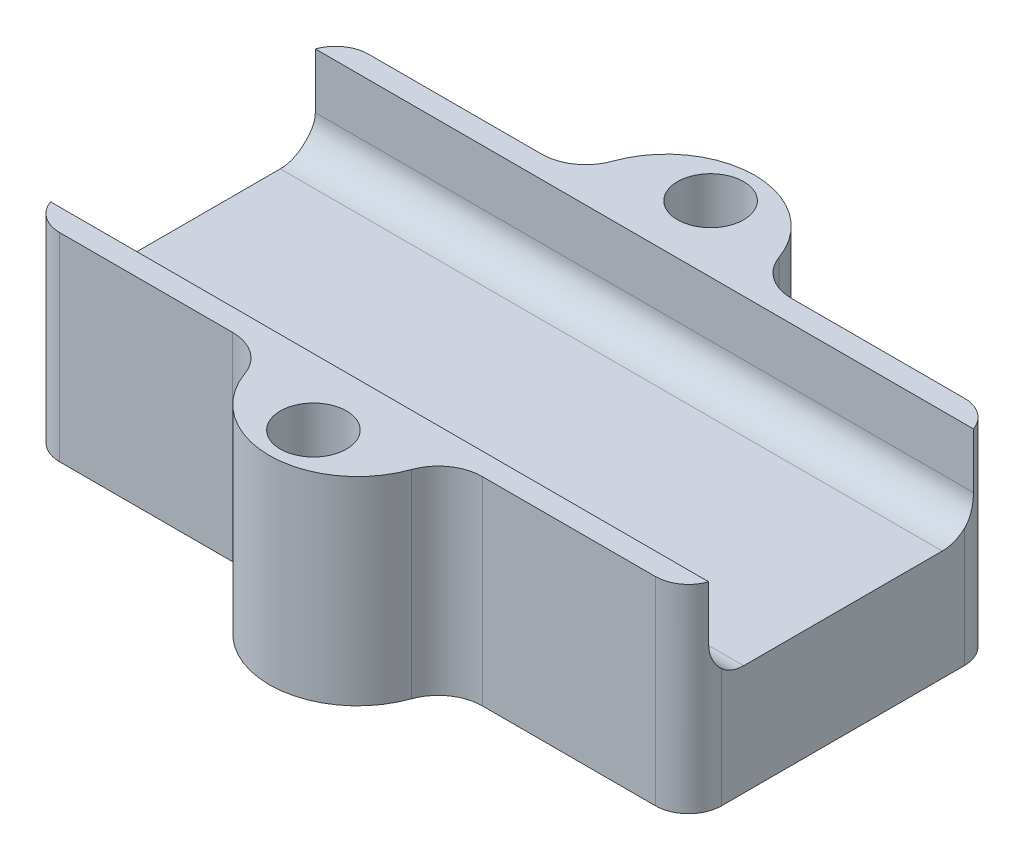
from build123d import *

# Parameters (mm, degrees)
BOSS_EXTRUDE1_DEPTH = 9
SKETCH2_W           = 30
SKETCH2_H           = 12
CUT_EXTRUDE1_DEPTH  = 4
FILLET1_R           = 2
FILLET2_R           = 1.5
SKETCH3_R           = 1.5
CUT_EXTRUDE2_DEPTH  = 21.66397832
SKETCH5_W           = 0.352564103
SKETCH5_H           = 2.5
BOSS_EXTRUDE2_DEPTH = 0.8
FILLET3_R           = 1.5


with BuildPart() as part:
    # Sketch1 → Boss-Extrude1 (new body)
    with BuildSketch(Plane(origin=(0, 0, 0), x_dir=(1, 0, 0), z_dir=(0, 1, 0))):
        with BuildLine():
            Line((-15, 7), (-4, 7))
            ThreePointArc((-4, 7), (0, 11), (4, 7))
            Line((4, 7), (15, 7))
            Line((15, 7), (15, -7))
            Line((15, -7), (4, -7))
            ThreePointArc((4, -7), (0, -11), (-4, -7))
            Line((-4, -7), (-15, -7))
            Line((-15, -7), (-15, 7))
        make_face()
    extrude(amount=BOSS_EXTRUDE1_DEPTH)

    # Sketch2 → Cut-Extrude1 (cut)
    with BuildSketch(Plane(origin=(0, 9, 0), x_dir=(1, 0, 0), z_dir=(0, 1, 0))):
        Rectangle(SKETCH2_W, SKETCH2_H)
    extrude(amount=-CUT_EXTRUDE1_DEPTH, mode=Mode.SUBTRACT)

    # Fillet1
    fillet1_edges = [part.edges().sort_by_distance(p)[0] for p in [
        (4, 4.5, 7),
        (-4, 4.5, 7),
        (-4, 4.5, -7),
        (4, 4.5, -7),
    ]]
    fillet(fillet1_edges, radius=FILLET1_R)

    # Fillet2
    fillet2_edges = [part.edges().sort_by_distance(p)[0] for p in [
        (15, 4.5, -7),
        (15, 4.5, 7),
        (-15, 4.5, 7),
        (-15, 4.5, -7),
    ]]
    fillet(fillet2_edges, radius=FILLET2_R)

    # Sketch3 → Cut-Extrude2 (cut, through all)
    with BuildSketch(Plane.XZ):
        with Locations(Location((0, 9, 0), (0, 0, 270))):
            Circle(SKETCH3_R)
        with Locations(Location((0, -9, 0), (0, 0, 270))):
            Circle(SKETCH3_R)
    extrude(amount=-CUT_EXTRUDE2_DEPTH, mode=Mode.SUBTRACT)

    # Sketch5 → Boss-Extrude2 (add)
    # profile 1 of 4: a face of its own
    with BuildSketch(Plane.ZY.offset(15)):
        with BuildLine():
            Line((-4.246529461, 1.228618218), (-4.246529461, 3.728618218))
            Line((-4.246529461, 3.728618218), (-3.716180904, 3.728618218))
            Line((-3.716180904, 3.728618218), (-3.157286673, 1.974311327))
            add(Edge.make_bspline(
                [(-3.157286673, 1.974311327), (-3.151136018, 1.954438087), (-3.13924101, 1.916004398), (-3.121602124, 1.860502615), (-3.105553695, 1.808926148), (-3.091099557, 1.761110827), (-3.077459001, 1.717294053), (-3.065648428, 1.677116277), (-3.054357136, 1.641023963), (-3.047739935, 1.618086117), (-3.044606384, 1.607223987)],
                knots=[0, 0, 0, 0, 1.300204174, 2.514519184, 3.639827924, 4.676153899, 5.636536826, 6.507959918, 7.293450077, 8, 8, 8, 8], degree=3))
            add(Edge.make_bspline(
                [(-3.044606384, 1.607223987), (-3.041116337, 1.619080952), (-3.033689292, 1.64431333), (-3.021648865, 1.683986921), (-3.008837508, 1.727890213), (-2.99350624, 1.775268581), (-2.977525209, 1.826865242), (-2.960751036, 1.882637348), (-2.941402354, 1.94202808), (-2.928544188, 1.983145197), (-2.92191007, 2.004359404)],
                knots=[0, 0, 0, 0, 0.713638162, 1.518667645, 2.393860736, 3.354087503, 4.393659122, 5.512594909, 6.716633584, 8, 8, 8, 8], degree=3))
            Line((-2.92191007, 2.004359404), (-2.368524654, 3.728618218))
            Line((-2.368524654, 3.728618218), (-1.842683308, 3.728618218))
            Line((-1.842683308, 3.728618218), (-1.842683308, 1.228618218))
            Line((-1.842683308, 1.228618218), (-2.19524741, 1.228618218))
            Line((-2.19524741, 1.228618218), (-2.19524741, 3.344002833))
            Line((-2.19524741, 3.344002833), (-2.862314718, 1.228618218))
            Line((-2.862314718, 1.228618218), (-3.230904461, 1.228618218))
            Line((-3.230904461, 1.228618218), (-3.893965359, 3.344002833))
            Line((-3.893965359, 3.344002833), (-3.893965359, 1.228618218))
            Line((-3.893965359, 1.228618218), (-4.246529461, 1.228618218))
        make_face()
    # profile 2 of 4: a face of its own
    with BuildSketch(Plane.ZY.offset(15)):
        with Locations((-1.121529461, 2.478618218)):
            Rectangle(SKETCH5_W, SKETCH5_H)
    # profile 3 of 4: a face of its own
    with BuildSketch(Plane.ZY.offset(15)):
        with BuildLine():
            Line((1.330393616, 2.111030077), (1.682957718, 2.028898666))
            add(Edge.make_bspline(
                [(1.682957718, 2.028898666), (1.674125003, 1.995853813), (1.656847117, 1.931213977), (1.622686636, 1.838707217), (1.584345686, 1.751893569), (1.540893941, 1.671001714), (1.491855826, 1.596496732), (1.438530653, 1.52742109), (1.378806287, 1.465223368), (1.314874087, 1.408468076), (1.24623627, 1.358410061), (1.173720373, 1.315184046), (1.097676923, 1.278407481), (1.017798575, 1.248164693), (0.934033544, 1.225404402), (0.846813137, 1.208815368), (0.755883026, 1.19859749), (0.693901944, 1.197252276), (0.662324705, 1.196566936)],
                knots=[0, 0, 0, 0, 1.145254194, 2.240259345, 3.299159039, 4.322497661, 5.312016644, 6.284080175, 7.241264552, 8.196044782, 9.144516039, 10.082428046, 11.020306713, 11.970622414, 12.939253955, 13.924100776, 14.94240044, 16, 16, 16, 16], degree=3))
            add(Edge.make_bspline(
                [(0.662324705, 1.196566936), (0.629925847, 1.197037633), (0.56654007, 1.197958514), (0.47368356, 1.20544872), (0.385367902, 1.218439316), (0.301758022, 1.236487891), (0.222572499, 1.258803831), (0.148139695, 1.28687926), (0.07858998, 1.320511606), (0.013343219, 1.358760274), (-0.047323465, 1.402212484), (-0.104789652, 1.449695578), (-0.157660255, 1.502516714), (-0.207257238, 1.559428735), (-0.252500361, 1.62118239), (-0.29505413, 1.686938729), (-0.332841517, 1.757856377), (-0.367262896, 1.832620519), (-0.397475276, 1.910507303), (-0.424202665, 1.989978251), (-0.446053766, 2.071191716), (-0.464866155, 2.153464301), (-0.478532443, 2.237488275), (-0.489383053, 2.322633199), (-0.495348937, 2.409421086), (-0.496133984, 2.46775927), (-0.496529461, 2.497147865)],
                knots=[0, 0, 0, 0, 1.180702053, 2.309949215, 3.392367133, 4.431746864, 5.425408375, 6.388154007, 7.326956194, 8.237882283, 9.141054626, 10.043899035, 10.951650021, 11.86168169, 12.792564695, 13.739356664, 14.713891418, 15.718426911, 16.737522708, 17.757217648, 18.772674716, 19.801476837, 20.831699174, 21.873853055, 22.928926693, 24, 24, 24, 24], degree=3))
            add(Edge.make_bspline(
                [(-0.496529461, 2.497147865), (-0.495963845, 2.528874039), (-0.494846331, 2.591556945), (-0.488537979, 2.684047392), (-0.476951824, 2.773311988), (-0.460862024, 2.859409449), (-0.44050199, 2.942409503), (-0.415369811, 3.022352586), (-0.385783408, 3.099136412), (-0.351832978, 3.17284565), (-0.313292962, 3.242657512), (-0.271313622, 3.30867124), (-0.224893589, 3.369802918), (-0.175409148, 3.427220484), (-0.121624391, 3.479967871), (-0.063703555, 3.528164564), (-0.002146355, 3.572250177), (0.063038224, 3.611815439), (0.130998144, 3.646531886), (0.20072398, 3.677454128), (0.272493063, 3.702799109), (0.345736386, 3.723872441), (0.420611636, 3.740648772), (0.497293767, 3.751867156), (0.575711924, 3.759177924), (0.628587569, 3.760168709), (0.655313487, 3.7606695)],
                knots=[0, 0, 0, 0, 1.185634383, 2.342514083, 3.462112933, 4.547331452, 5.613960142, 6.653690668, 7.676612054, 8.686959706, 9.683658101, 10.654407272, 11.607580201, 12.5494388, 13.484601218, 14.419076806, 15.362504069, 16.311442244, 17.265594461, 18.212500624, 19.159571152, 20.107257795, 21.059246075, 22.024387127, 23.001429356, 24, 24, 24, 24], degree=3))
            add(Edge.make_bspline(
                [(0.655313487, 3.7606695), (0.685216189, 3.760105849), (0.74399291, 3.758997937), (0.830237276, 3.749885141), (0.912836861, 3.734622206), (0.992149583, 3.71459868), (1.067350844, 3.687182304), (1.139257082, 3.654587383), (1.207152973, 3.615428535), (1.271566804, 3.570781915), (1.331450018, 3.520565183), (1.387640617, 3.465978005), (1.437847443, 3.405656098), (1.484058991, 3.341059361), (1.524821292, 3.271292057), (1.561633951, 3.196962482), (1.593291766, 3.117518081), (1.610230273, 3.062182858), (1.618855154, 3.03400684)],
                knots=[0, 0, 0, 0, 1.098391872, 2.158997981, 3.181470371, 4.182549255, 5.160268219, 6.118029851, 7.079534476, 8.035645336, 8.993622929, 9.94770573, 10.909620999, 11.872786677, 12.862530088, 13.874594564, 14.917769567, 16, 16, 16, 16], degree=3))
            Line((1.618855154, 3.03400684), (1.266291051, 2.958385846))
            add(Edge.make_bspline(
                [(1.266291051, 2.958385846), (1.259367243, 2.980009493), (1.245815207, 3.022333662), (1.221752242, 3.082653124), (1.195765041, 3.138649292), (1.16723457, 3.189941529), (1.136098995, 3.236542122), (1.103075287, 3.279017432), (1.067372231, 3.316574649), (1.029716057, 3.350079751), (0.989134371, 3.378622891), (0.946578585, 3.403916811), (0.901151411, 3.424843672), (0.853506351, 3.442543474), (0.803198073, 3.45601493), (0.750431438, 3.465492631), (0.695160085, 3.47097786), (0.657495762, 3.471792486), (0.638286244, 3.472207961)],
                knots=[0, 0, 0, 0, 1.235697765, 2.418642872, 3.532555292, 4.594392283, 5.610119701, 6.580908344, 7.519430642, 8.427315627, 9.319973334, 10.216139639, 11.118687699, 12.038725643, 12.980015607, 13.949697744, 14.954307006, 16, 16, 16, 16], degree=3))
            add(Edge.make_bspline(
                [(0.638286244, 3.472207961), (0.61623196, 3.471887976), (0.572857691, 3.471258658), (0.509135672, 3.464370847), (0.447940371, 3.454225774), (0.389727873, 3.439012364), (0.334179636, 3.420045199), (0.281625293, 3.396427722), (0.231617794, 3.368745268), (0.184715246, 3.336831602), (0.141311824, 3.300954499), (0.100229685, 3.263026788), (0.063441227, 3.221279607), (0.029543595, 3.177089526), (-0.000476111, 3.129675673), (-0.027498876, 3.079683884), (-0.051352449, 3.026704436), (-0.077354464, 2.952139876), (-0.103867003, 2.856102446), (-0.126866663, 2.73858376), (-0.141516904, 2.619213575), (-0.143147482, 2.538923013), (-0.143965359, 2.498650269)],
                knots=[0, 0, 0, 0, 0.935256702, 1.839373932, 2.716087708, 3.564631604, 4.388828665, 5.203538865, 6.005592122, 6.810952829, 7.606223804, 8.392839071, 9.180346482, 9.963639178, 10.753404291, 11.558266631, 12.372976832, 13.215232055, 14.905983541, 16.594894834, 18.292041732, 20, 20, 20, 20], degree=3))
            add(Edge.make_bspline(
                [(-0.143965359, 2.498650269), (-0.143042909, 2.448014033), (-0.141253274, 2.349775149), (-0.12359397, 2.20741078), (-0.096669941, 2.074623143), (-0.064176516, 1.971022329), (-0.031582346, 1.894604418), (-0.005221819, 1.841087853), (0.024867671, 1.791566219), (0.057937689, 1.745758279), (0.09441421, 1.703797651), (0.133789045, 1.665461439), (0.176070986, 1.630380757), (0.221761038, 1.600197796), (0.269100531, 1.573397959), (0.317492079, 1.549567032), (0.366966152, 1.529411889), (0.417722354, 1.513754964), (0.469047935, 1.500225204), (0.521508191, 1.49138693), (0.575088164, 1.486398887), (0.61106579, 1.485488941), (0.629271821, 1.485028474)],
                knots=[0, 0, 0, 0, 2.10686522, 4.087509323, 5.961373225, 7.741398778, 8.594514555, 9.418024779, 10.222433421, 11.003575649, 11.767087398, 12.533660211, 13.289033706, 14.050297079, 14.809623433, 15.552362432, 16.294320901, 17.0305302, 17.761969017, 18.502233515, 19.242073914, 20, 20, 20, 20], degree=3))
            add(Edge.make_bspline(
                [(0.629271821, 1.485028474), (0.650998225, 1.485484123), (0.693915555, 1.486384189), (0.756837811, 1.494262524), (0.817493999, 1.50587228), (0.875149276, 1.523787306), (0.930579172, 1.545722157), (0.983329534, 1.572771664), (1.03323447, 1.605304326), (1.080880972, 1.642242107), (1.125390395, 1.684270991), (1.16618089, 1.731052371), (1.202774572, 1.782799518), (1.236706123, 1.838681964), (1.265214863, 1.900369125), (1.291620687, 1.966022379), (1.313623928, 2.036720795), (1.32472342, 2.085904495), (1.330393616, 2.111030077)],
                knots=[0, 0, 0, 0, 1.013374089, 2.001772144, 2.95501459, 3.891367103, 4.814208647, 5.733921849, 6.652182523, 7.590185968, 8.54346024, 9.504121027, 10.481158517, 11.497760682, 12.549996529, 13.647863555, 14.798406869, 16, 16, 16, 16], degree=3))
        make_face()
    # profile 4 of 4: a face of its own
    with BuildSketch(Plane.ZY.offset(15)):
        with BuildLine():
            add(Edge.make_bspline(
                [(2.003470539, 2.445565333), (2.004339442, 2.495688178), (2.006032457, 2.59335), (2.021851209, 2.735558197), (2.047536801, 2.869357509), (2.084256627, 2.99473751), (2.130799113, 3.111894674), (2.187380395, 3.221094285), (2.255702402, 3.32110028), (2.332992001, 3.412864653), (2.419320934, 3.493991085), (2.51123671, 3.56604298), (2.60988707, 3.626142778), (2.71436056, 3.675765398), (2.825101042, 3.713864209), (2.941797591, 3.740536843), (3.0643254, 3.757743285), (3.148076026, 3.759679927), (3.190870378, 3.7606695)],
                knots=[0, 0, 0, 0, 1.203621547, 2.345195544, 3.432004029, 4.472479546, 5.478447225, 6.455936844, 7.420185704, 8.381829745, 9.332027588, 10.260832629, 11.182364398, 12.100723901, 13.034044877, 13.989196293, 14.972532542, 16, 16, 16, 16], degree=3))
            add(Edge.make_bspline(
                [(3.190870378, 3.7606695), (3.219096194, 3.760176624), (3.27514756, 3.759197862), (3.358014501, 3.751750787), (3.438752053, 3.738459049), (3.51728071, 3.72064663), (3.593814228, 3.697277511), (3.66839831, 3.669690977), (3.740380056, 3.635507376), (3.810238342, 3.597235434), (3.877148543, 3.554426612), (3.940030582, 3.507135793), (3.998733837, 3.455720636), (4.054046852, 3.401026265), (4.104123909, 3.341206822), (4.15103382, 3.27808451), (4.1934286, 3.210540067), (4.231458675, 3.139126907), (4.265461426, 3.064947992), (4.294523344, 2.98769588), (4.319478282, 2.908297266), (4.340367671, 2.826282194), (4.355356371, 2.741678703), (4.367292035, 2.65485134), (4.373574104, 2.565516324), (4.374696886, 2.505168929), (4.37526541, 2.474611808)],
                knots=[0, 0, 0, 0, 1.034375294, 2.054082248, 3.045783978, 4.031219655, 5.002789406, 5.976610191, 6.94273282, 7.920236376, 8.894345378, 9.851183672, 10.800797181, 11.752517031, 12.698794154, 13.65688337, 14.632873302, 15.61821402, 16.620222298, 17.621258913, 18.640965868, 19.669244166, 20.720417492, 21.788124603, 22.880008887, 24, 24, 24, 24], degree=3))
            add(Edge.make_bspline(
                [(4.37526541, 2.474611808), (4.374744518, 2.443550798), (4.373715406, 2.382184418), (4.366752009, 2.291527499), (4.354507938, 2.203473152), (4.338268263, 2.117758816), (4.316507594, 2.034562928), (4.290648382, 1.953646963), (4.259370205, 1.87549287), (4.224044976, 1.799912284), (4.184074495, 1.727944698), (4.139984342, 1.660093346), (4.091743283, 1.596992921), (4.040084093, 1.537869343), (3.983800393, 1.483779853), (3.92358524, 1.434218674), (3.859670161, 1.388718387), (3.791840435, 1.348511283), (3.721313357, 1.31326832), (3.649484548, 1.282001462), (3.576300652, 1.255335842), (3.501511548, 1.233726007), (3.425321254, 1.21739606), (3.347944178, 1.205168024), (3.269126668, 1.198127078), (3.216090823, 1.197089656), (3.189367975, 1.196566936)],
                knots=[0, 0, 0, 0, 1.141429366, 2.255090526, 3.338676798, 4.407031443, 5.458968682, 6.496860253, 7.526652771, 8.550250826, 9.560787671, 10.54935636, 11.521089193, 12.477323897, 13.431786008, 14.386110112, 15.340986122, 16.312041, 17.28047646, 18.236612773, 19.189437236, 20.140779471, 21.09494583, 22.051062463, 23.018000708, 24, 24, 24, 24], degree=3))
            add(Edge.make_bspline(
                [(3.189367975, 1.196566936), (3.160634977, 1.196992044), (3.103722106, 1.197834077), (3.019603348, 1.206239002), (2.937577334, 1.219061007), (2.857882526, 1.237572109), (2.780627824, 1.261721149), (2.705721819, 1.290950383), (2.632901058, 1.324869171), (2.563069127, 1.36444872), (2.496463704, 1.408456924), (2.433730353, 1.456675019), (2.374903765, 1.508658635), (2.320927864, 1.565266997), (2.270054541, 1.624448031), (2.22431794, 1.688401458), (2.182224375, 1.755676883), (2.145019465, 1.826922811), (2.111410396, 1.900022084), (2.083094029, 1.974998083), (2.05820943, 2.050745862), (2.038391367, 2.127732298), (2.022598782, 2.205779802), (2.011979412, 2.284758505), (2.004310023, 2.364786032), (2.003751775, 2.418503396), (2.003470539, 2.445565333)],
                knots=[0, 0, 0, 0, 1.072727997, 2.12480551, 3.153819198, 4.171534612, 5.177148798, 6.173931848, 7.17235114, 8.174500385, 9.168706755, 10.151274001, 11.127173509, 12.097141049, 13.070188938, 14.039134204, 15.03036519, 16.031505612, 17.038625933, 18.033164522, 19.022845559, 20.014762458, 21.000193215, 21.994692725, 22.989758729, 24, 24, 24, 24], degree=3))
        make_face()
        with BuildLine():
            add(Edge.make_bspline(
                [(2.356034641, 2.441558923), (2.356574929, 2.405465952), (2.357628452, 2.335087206), (2.369681326, 2.232478736), (2.387969637, 2.13566242), (2.413178143, 2.044366471), (2.447064549, 1.959493791), (2.487580134, 1.880228837), (2.536089069, 1.807098517), (2.5915211, 1.740307406), (2.652489981, 1.680307276), (2.717641417, 1.627900355), (2.786990055, 1.584013265), (2.859767041, 1.547775103), (2.936495098, 1.519487914), (3.016944426, 1.499625362), (3.101174134, 1.487202949), (3.158608407, 1.485762329), (3.187865571, 1.485028474)],
                knots=[0, 0, 0, 0, 1.215430442, 2.370003584, 3.475209778, 4.53279855, 5.55522989, 6.548792651, 7.526809858, 8.505409025, 9.467826767, 10.404123909, 11.316848639, 12.227335424, 13.138360512, 14.065900994, 15.014765094, 16, 16, 16, 16], degree=3))
            add(Edge.make_bspline(
                [(3.187865571, 1.485028474), (3.217618644, 1.485773184), (3.275875079, 1.487231322), (3.361374664, 1.49943688), (3.442608841, 1.520216322), (3.520382785, 1.547878466), (3.593290419, 1.585272969), (3.663036845, 1.629061728), (3.727720765, 1.682570336), (3.788929988, 1.742676582), (3.843830537, 1.81099837), (3.892543217, 1.885852717), (3.932113969, 1.968362247), (3.966277973, 2.056709389), (3.991294825, 2.152563936), (4.009783812, 2.254836216), (4.020925667, 2.363855207), (4.022098962, 2.438694721), (4.022701308, 2.477115814)],
                knots=[0, 0, 0, 0, 0.976878588, 1.912725521, 2.8289017, 3.727303729, 4.617335839, 5.514666588, 6.426584173, 7.368641557, 8.327632997, 9.299405846, 10.294892156, 11.327373912, 12.405931897, 13.542618837, 14.738430195, 16, 16, 16, 16], degree=3))
            add(Edge.make_bspline(
                [(4.022701308, 2.477115814), (4.022488439, 2.501833445), (4.022070868, 2.550320491), (4.016540821, 2.621790952), (4.009407771, 2.691038273), (3.998547591, 2.757973099), (3.983580886, 2.822318239), (3.967000317, 2.884563553), (3.946266897, 2.944172645), (3.922741941, 3.001379279), (3.896417915, 3.055889768), (3.866727914, 3.107244566), (3.834016997, 3.155244017), (3.799167743, 3.200798142), (3.760250398, 3.24214381), (3.719138854, 3.281027481), (3.674899265, 3.31664581), (3.627973125, 3.349008101), (3.579026142, 3.378139263), (3.528159221, 3.403071758), (3.476182743, 3.424971822), (3.422226697, 3.441759141), (3.36703611, 3.455298359), (3.310387874, 3.465582657), (3.252071724, 3.470908345), (3.212748, 3.471771645), (3.192873584, 3.472207961)],
                knots=[0, 0, 0, 0, 1.220438779, 2.394059227, 3.538503547, 4.658058814, 5.74010225, 6.800155734, 7.837851593, 8.854470756, 9.853724944, 10.825214244, 11.781044712, 12.72106398, 13.654479919, 14.581868691, 15.514082315, 16.456304431, 17.39516604, 18.324312202, 19.252140633, 20.177768678, 21.111585046, 22.057694709, 23.018348693, 24, 24, 24, 24], degree=3))
            add(Edge.make_bspline(
                [(3.192873584, 3.472207961), (3.164783806, 3.471650109), (3.109359546, 3.470549406), (3.027768437, 3.458313372), (2.949105762, 3.440031067), (2.873249443, 3.414471429), (2.80084827, 3.380626453), (2.731527137, 3.33912022), (2.664670718, 3.291082882), (2.601333244, 3.235344018), (2.542288863, 3.171313671), (2.492372763, 3.095823853), (2.450302111, 3.010676665), (2.41517389, 2.916087937), (2.388389657, 2.811325139), (2.369878402, 2.696839117), (2.358190773, 2.572509229), (2.356771726, 2.486324941), (2.356034641, 2.441558923)],
                knots=[0, 0, 0, 0, 0.895090134, 1.766112571, 2.624765742, 3.468151641, 4.313618154, 5.168136083, 6.041303099, 6.935189387, 7.854749729, 8.809996334, 9.809869957, 10.877771942, 12.021723904, 13.25217762, 14.572720513, 16, 16, 16, 16], degree=3))
        make_face(mode=Mode.SUBTRACT)
    extrude(amount=BOSS_EXTRUDE2_DEPTH)

    # Fillet3
    fillet3_edges = [part.edges().sort_by_distance(p)[0] for p in [
        (0, 5, 6),
        (0, 5, -6),
    ]]
    fillet(fillet3_edges, radius=FILLET3_R)


solid = part.part
